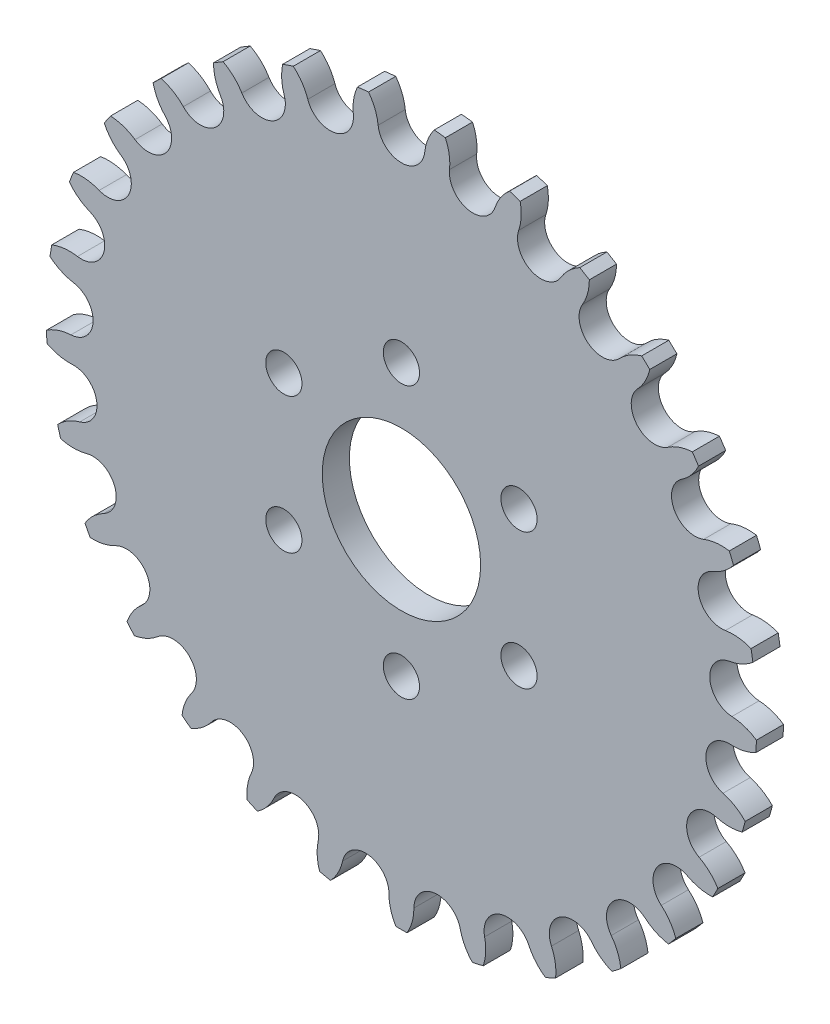
from build123d import *

# Parameters (mm, degrees)
EXTRUDE_1_DEPTH          = 6
PATTERN_CIRCULAR_1_COUNT = 29
SKETCH_3_R               = 17.5
SKETCH_3_R_2             = 4
CUT_EXTRUDE_1_DEPTH      = 112.129041512


with BuildPart() as part:
    # Эскиз2 → Бобышка-Вытянуть1 (new body)
    with BuildSketch(Plane.XY):
        with BuildLine():
            Line((0, 0), (0, 68.234465981))
            ThreePointArc((0, 68.234465981), (3.459140591, 69.558723981), (5.149634618, 72.854409466))
            ThreePointArc((5.149634618, 72.854409466), (5.843687226, 75.649551657), (7.258416048, 78.158151118))
            ThreePointArc((7.258416048, 78.158151118), (8.486744614, 78.034328058), (9.712973838, 77.891201871))
            ThreePointArc((9.712973838, 77.891201871), (10.555352355, 75.137127194), (10.632305452, 72.258133079))
            ThreePointArc((10.632305452, 72.258133079), (11.574801709, 68.676092644), (14.66839319, 66.639182085))
            Line((14.66839319, 66.639182085), (0, 0))
        make_face()
    extrude_1 = extrude(amount=EXTRUDE_1_DEPTH)

    # Круговой массив1: Бобышка-Вытянуть1 ×29 about axis
    pattern_circular_1_axis = Axis((0, 0, 0), (0, 0, 1))
    for i in range(1, PATTERN_CIRCULAR_1_COUNT):
        add(extrude_1.rotate(pattern_circular_1_axis, i * 360 / PATTERN_CIRCULAR_1_COUNT))

    # Эскиз3 → Вырез-Вытянуть1 (cut, through all)
    with BuildSketch(Plane.XY.offset(6)):
        Circle(SKETCH_3_R)
        with Locations((0, 30)):
            Circle(SKETCH_3_R_2)
        with Locations((25.980762114, 15)):
            Circle(SKETCH_3_R_2)
        with Locations((25.980762114, -15)):
            Circle(SKETCH_3_R_2)
        with Locations((0, -30)):
            Circle(SKETCH_3_R_2)
        with Locations((-25.980762114, -15)):
            Circle(SKETCH_3_R_2)
        with Locations((-25.980762114, 15)):
            Circle(SKETCH_3_R_2)
    extrude(amount=-CUT_EXTRUDE_1_DEPTH, mode=Mode.SUBTRACT)


solid = part.part
